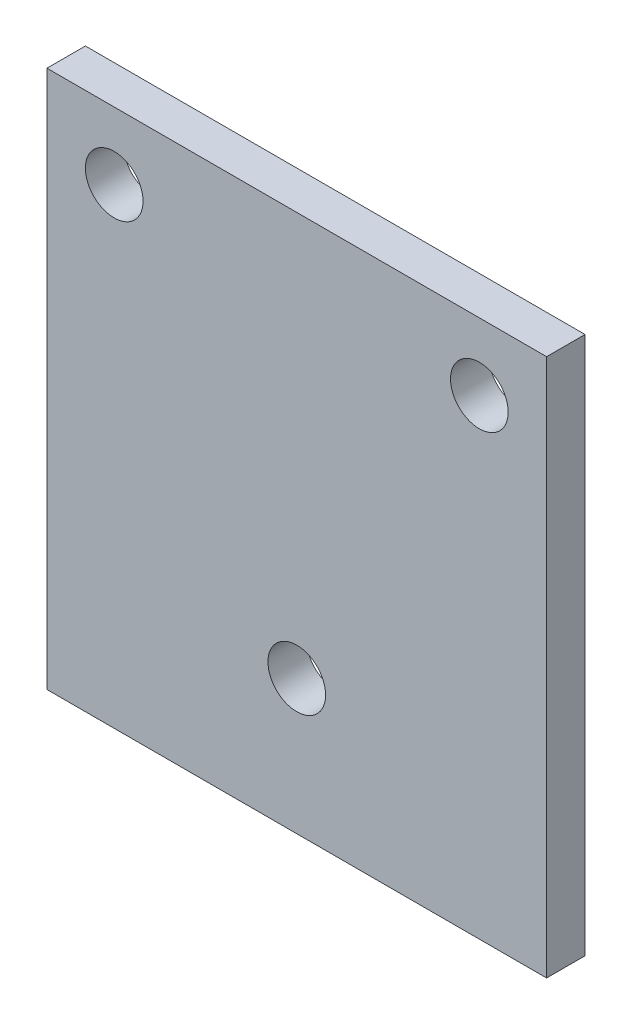
from build123d import *

# Parameters (mm, degrees)
CROQUIS1_W              = 26
CROQUIS1_H              = 28
CROQUIS1_R              = 1.5
SALIENTE_EXTRUIR1_DEPTH = 2


with BuildPart() as part:
    # Croquis1 → Saliente-Extruir1 (new body)
    with BuildSketch(Plane.XY):
        with Locations((-27.887270297, 1.536585366)):
            Rectangle(CROQUIS1_W, CROQUIS1_H)
        with Locations((-37.387270297, 12.036585366)):
            Circle(CROQUIS1_R, mode=Mode.SUBTRACT)
        with Locations(Location((-18.387270297, 12.036585366, 0), (0, 0, 180))):
            Circle(CROQUIS1_R, mode=Mode.SUBTRACT)
        with Locations((-27.887270297, -5.463414634)):
            Circle(CROQUIS1_R, mode=Mode.SUBTRACT)
    extrude(amount=SALIENTE_EXTRUIR1_DEPTH)


solid = part.part
